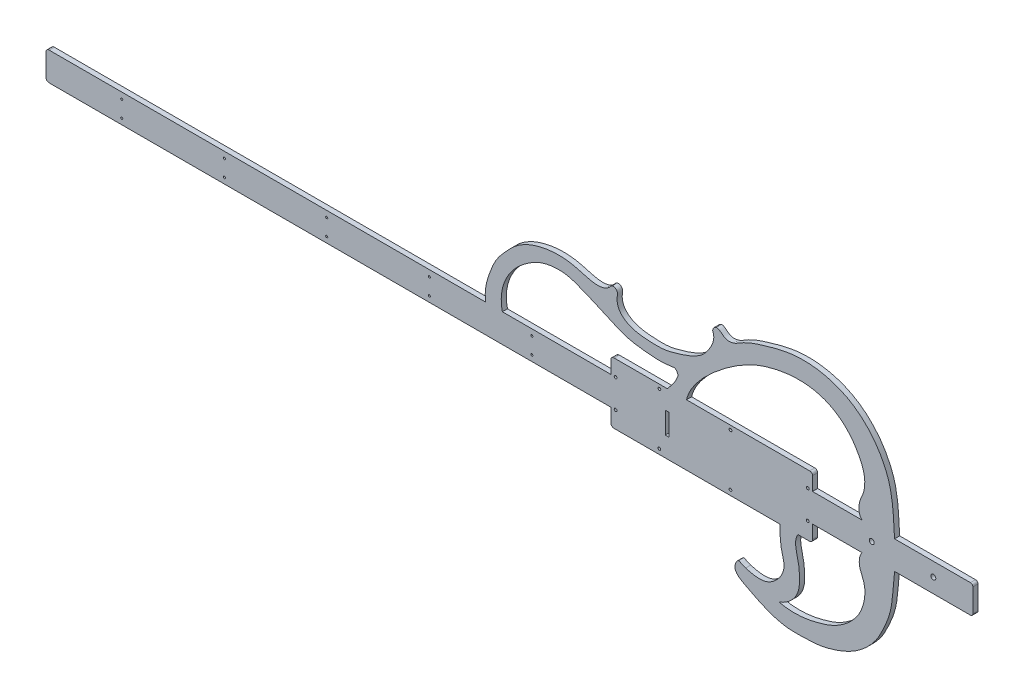
from build123d import *

# Parameters (mm, degrees)
SKETCH1_R           = 1.27
SKETCH1_R_2         = 1.720095417
SKETCH1_W           = 4.395895468
SKETCH1_H           = 26.756656412
SKETCH1_R_3         = 3.048
BOSS_EXTRUDE1_DEPTH = 6.35


with BuildPart() as part:
    # Sketch1 → Boss-Extrude1 (new body)
    with BuildSketch(Plane.XY):
        with BuildLine():
            Line((0.359622665, 112.547896558), (0.359622665, 84.647626996))
            ThreePointArc((0.359622665, 84.647626996), (1.569547298, 82.016705042), (4.285435965, 81.011908201))
            Line((4.285435965, 81.011908201), (699.960441306, 81.011908201))
            Line((699.960441306, 81.011908201), (699.960441306, 64.012598058))
            ThreePointArc((699.960441306, 64.012598058), (701.213068629, 61.288906282), (704.024750828, 60.24870663))
            Line((704.024750828, 60.24870663), (909.286197208, 60.24870663))
            add(Edge.make_bspline(
                [(866.883440258, -8.016888538), (874.996208069, -10.630011106), (889.582465134, -13.349674555), (904.754102276, -2.95793798), (912.646405573, 6.979428185), (915.467454602, 19.076193935), (909.876881939, 35.950201477), (909.359928546, 49.852763393), (909.286197208, 60.24870663)],
                knots=[0, 0, 0, 0, 0.253575557, 0.369607886, 0.505308287, 0.606582736, 0.705767559, 1, 1, 1, 1], degree=3))
            add(Edge.make_bspline(
                [(1051.373524781, 80.56870663), (1049.288127142, 64.650526229), (1049.88818517, 41.15296277), (1038.960901756, 14.635351575), (1030.033721858, -4.003031853), (1016.302858841, -19.587670347), (998.930235011, -32.049495928), (980.710504271, -39.994799999), (959.57894918, -45.955528305), (938.108660724, -46.630190525), (916.713848936, -46.888472713), (897.902005788, -41.731666781), (880.789552489, -34.28420289), (867.524414432, -27.199547471), (857.757493082, -22.04011477), (853.06855917, -15.368003413), (853.869053657, -9.281082738), (857.872680057, -3.254162116), (861.84748545, -6.487186688), (866.865577861, -8.023744377), (866.883440258, -8.016888538)],
                knots=[0, 0, 0, 0, 0.159781432, 0.22073232, 0.278896856, 0.361243423, 0.420244649, 0.486730637, 0.554562609, 0.633412937, 0.695861611, 0.762776951, 0.821949522, 0.878083655, 0.910083505, 0.929117979, 0.952627265, 0.969674335, 0.9829837, 1, 1, 1, 1], degree=3))
            Line((1051.373524781, 80.56870663), (1145.318968911, 80.56870663))
            ThreePointArc((1145.318968911, 80.56870663), (1147.47423038, 81.461445161), (1148.366968911, 83.61670663))
            Line((1148.366968911, 83.61670663), (1148.366968911, 112.444795653))
            ThreePointArc((1148.366968911, 112.444795653), (1147.47423038, 114.600057122), (1145.318968911, 115.492795653))
            Line((1145.318968911, 115.492795653), (1051.373524781, 115.492795653))
            add(Edge.make_bspline(
                [(1051.373524781, 115.492795653), (1050.085567845, 133.585169118), (1050.031748592, 165.853529466), (1030.489653884, 206.366381772), (1004.666685748, 232.661355303), (969.814698833, 248.855889629), (929.466791914, 253.119967796), (892.243263272, 243.135991048), (865.879505599, 234.346324949), (852.301494449, 224.647253002), (841.392349307, 224.656843506), (837.099080275, 229.209023083), (833.914039429, 231.303054702), (831.844974328, 232.226406665), (826.87829078, 231.174808269), (825.340112102, 226.071477889), (826.846296928, 223.844416195)],
                knots=[0, 0, 0, 0, 0.170259048, 0.292846894, 0.408935013, 0.505972757, 0.64534917, 0.775869817, 0.861927566, 0.902740597, 0.927960686, 0.955006989, 0.957766717, 0.963493972, 0.975689055, 1, 1, 1, 1], degree=3))
            add(Edge.make_bspline(
                [(826.846296928, 223.844416195), (828.1441551, 219.815491892), (826.405981943, 211.963531121), (820.920958395, 202.620715011), (814.303227062, 194.177043953), (801.537014519, 185.882402122), (784.687293461, 180.181940997), (764.518925037, 174.766393306), (746.225954239, 175.722168548), (729.920820026, 177.231385826), (717.783284419, 182.225149694), (709.22312443, 190.233303454), (707.268395716, 199.202588574), (708.098277515, 205.104454515), (708.418453014, 210.901354403), (702.511886729, 213.413706755), (699.960441306, 210.973496645)],
                knots=[0, 0, 0, 0, 0.072482113, 0.13088373, 0.189047214, 0.256659028, 0.3915451, 0.49712301, 0.616589293, 0.706951108, 0.780369561, 0.840844517, 0.903160581, 0.929303787, 0.945816026, 1, 1, 1, 1], degree=3))
            add(Edge.make_bspline(
                [(545.068679485, 116.18243367), (543.003944869, 127.306395669), (547.835188666, 146.50666263), (557.831391281, 170.078633417), (570.229050884, 183.087633665), (580.719792418, 194.642079707), (593.5777802, 202.996739544), (609.448319418, 208.86698225), (626.176829351, 211.953667548), (643.646109213, 212.256774791), (659.486622395, 208.88988684), (672.366772331, 204.896746195), (683.479003472, 202.983497948), (693.477852728, 204.629583715), (698.499191276, 208.660666551), (699.960441306, 210.973496645)],
                knots=[0, 0, 0, 0, 0.155145898, 0.270667715, 0.352919031, 0.403875103, 0.488427755, 0.56351451, 0.63903581, 0.725011604, 0.805518134, 0.863878342, 0.913359786, 0.962090462, 1, 1, 1, 1], degree=3))
            Line((545.068679485, 116.18243367), (4.285435965, 116.18243367))
            ThreePointArc((4.285435965, 116.18243367), (1.569792033, 115.17822767), (0.359622665, 112.547896558))
        make_face()
        with BuildLine():
            Line((699.960441306, 116.18243367), (565.564682143, 116.18243367))
            add(Edge.make_bspline(
                [(565.564682143, 116.18243367), (563.226872964, 126.247558426), (564.563870169, 146.978403139), (579.525164002, 170.383648282), (596.804717428, 184.496588222), (611.973268858, 192.885941946), (627.707346003, 196.323282932), (644.186801908, 196.673574965), (660.931161335, 190.919967617), (679.49477656, 183.346510635), (699.584741427, 173.632525371), (720.745026095, 164.98841516), (746.494131876, 161.433333264), (764.358224053, 160.291522579), (775.870604305, 162.344713358)],
                knots=[0, 0, 0, 0, 0.116254019, 0.223750827, 0.302299532, 0.366198057, 0.416538643, 0.482369053, 0.548714552, 0.613739129, 0.708376571, 0.800110483, 0.868979849, 1, 1, 1, 1], degree=3))
            add(Edge.make_bspline(
                [(775.870604305, 162.344713358), (779.488866181, 164.133703127), (784.519124227, 158.321863711), (781.510753604, 152.356369762), (778.113755949, 145.046519293), (773.087990045, 139.877099284), (770.011014066, 135.812795653)],
                knots=[0, 0, 0, 0, 0.303753327, 0.400343831, 0.557599877, 1, 1, 1, 1], degree=3))
            Line((770.011014066, 135.812795653), (704.024750828, 135.812795653))
            ThreePointArc((704.024750828, 135.812795653), (701.183091811, 134.700225562), (699.960441306, 131.904163347))
            Line((699.960441306, 131.904163347), (699.960441306, 116.18243367))
        make_face(mode=Mode.SUBTRACT)
        with BuildLine():
            Line((943.890172073, 135.812795653), (793.653450035, 135.812795653))
            add(Edge.make_bspline(
                [(1010.956707906, 115.492795653), (1007.967519446, 118.557852299), (1006.44520792, 126.418493459), (1008.601489172, 136.81034488), (1012.744531036, 144.329280892), (1014.208241343, 151.910712426), (1014.83521591, 160.351901877), (1012.367043029, 172.880962297), (1004.884481127, 187.9768728), (993.360653721, 203.787764201), (978.460122223, 215.511614276), (960.961741427, 223.784439146), (938.608552625, 227.832891389), (910.700110812, 226.068897979), (877.250076253, 216.870260714), (847.805509367, 198.967305375), (823.283440326, 179.180260176), (804.873915285, 159.868379039), (795.777179698, 144.642908038), (793.653450035, 135.812795653)],
                knots=[0, 0, 0, 0, 0.036323951, 0.06811831, 0.092953785, 0.112116261, 0.136404545, 0.16807032, 0.224491629, 0.285321924, 0.341045563, 0.391564503, 0.456512524, 0.541138816, 0.638971389, 0.762802321, 0.845038133, 0.919560661, 1, 1, 1, 1], degree=3))
            Line((1010.956707906, 115.492795653), (949.738968911, 115.492795653))
            Line((949.738968911, 115.492795653), (949.738968911, 132.475411377))
            ThreePointArc((949.738968911, 132.475411377), (948.657072186, 134.878542119), (946.192785632, 135.812795653))
            Line((946.192785632, 135.812795653), (943.890172073, 135.812795653))
        make_face(mode=Mode.SUBTRACT)
        with BuildLine():
            Line((949.738968911, 80.56870663), (1010.956707906, 80.56870663))
            add(Edge.make_bspline(
                [(907.924805009, -23.799079293), (924.25654034, -27.815584387), (948.454206412, -25.270778028), (978.199946498, -15.109602732), (995.962405074, -2.658838724), (1008.935667748, 13.408192449), (1014.56675733, 30.589912872), (1015.072043006, 45.322836602), (1011.233604334, 55.731662703), (1006.452327286, 66.550512981), (1007.823761663, 75.782174911), (1010.956707906, 80.56870663)],
                knots=[0, 0, 0, 0, 0.272312479, 0.391790224, 0.513826735, 0.624029674, 0.725126906, 0.806543023, 0.860469863, 0.90617368, 1, 1, 1, 1], degree=3))
            add(Edge.make_bspline(
                [(931.72901064, 60.24870663), (926.371333174, 51.921584385), (931.879117456, 36.200486978), (934.283414601, 15.747939395), (932.717203407, -7.865376158), (918.332792966, -20.46407755), (907.924805009, -23.799079293)],
                knots=[0, 0, 0, 0, 0.282393259, 0.484892607, 0.651403546, 1, 1, 1, 1], degree=3))
            Line((931.72901064, 60.24870663), (943.890172073, 60.24870663))
            Line((943.890172073, 60.24870663), (946.192785632, 60.24870663))
            ThreePointArc((946.192785632, 60.24870663), (948.74540471, 61.39621374), (949.738968911, 64.012598058))
            Line((949.738968911, 64.012598058), (949.738968911, 80.56870663))
        make_face(mode=Mode.SUBTRACT)
        with Locations((94.1622142, 88.091107164)):
            Circle(SKETCH1_R, mode=Mode.SUBTRACT)
        with Locations((221.392126764, 88.091107164)):
            Circle(SKETCH1_R, mode=Mode.SUBTRACT)
        with Locations((348.078760153, 88.091107164)):
            Circle(SKETCH1_R, mode=Mode.SUBTRACT)
        with Locations((475.146430575, 88.091107164)):
            Circle(SKETCH1_R, mode=Mode.SUBTRACT)
        with Locations((705.892847696, 81.011908201)):
            Circle(SKETCH1_R_2, mode=Mode.SUBTRACT)
        with Locations((602.130384222, 88.091107164)):
            Circle(SKETCH1_R, mode=Mode.SUBTRACT)
        with Locations((760.070975046, 66.505299661)):
            Circle(SKETCH1_R_2, mode=Mode.SUBTRACT)
        with Locations((848.138968911, 66.505299661)):
            Circle(SKETCH1_R_2, mode=Mode.SUBTRACT)
        with Locations((769.573881411, 98.171002455)):
            Rectangle(SKETCH1_W, SKETCH1_H, mode=Mode.SUBTRACT)
        with Locations((943.890172073, 81.011908201)):
            Circle(SKETCH1_R_2, mode=Mode.SUBTRACT)
        with Locations((1023.106655082, 98.527788179)):
            Circle(SKETCH1_R_3, mode=Mode.SUBTRACT)
        with Locations((1099.420523291, 98.527788179)):
            Circle(SKETCH1_R_3, mode=Mode.SUBTRACT)
        with Locations((94.1622142, 108.484732819)):
            Circle(SKETCH1_R, mode=Mode.SUBTRACT)
        with Locations((221.392126764, 108.484732819)):
            Circle(SKETCH1_R, mode=Mode.SUBTRACT)
        with Locations((348.078760153, 108.484732819)):
            Circle(SKETCH1_R, mode=Mode.SUBTRACT)
        with Locations((475.146430575, 108.484732819)):
            Circle(SKETCH1_R, mode=Mode.SUBTRACT)
        with Locations((602.130384222, 108.484732819)):
            Circle(SKETCH1_R, mode=Mode.SUBTRACT)
        with Locations((705.892847696, 116.18243367)):
            Circle(SKETCH1_R_2, mode=Mode.SUBTRACT)
        with Locations((760.070975046, 130.611938178)):
            Circle(SKETCH1_R_2, mode=Mode.SUBTRACT)
        with Locations((848.138968911, 130.611938178)):
            Circle(SKETCH1_R_2, mode=Mode.SUBTRACT)
        with Locations((943.890172073, 116.18243367)):
            Circle(SKETCH1_R_2, mode=Mode.SUBTRACT)
    extrude(amount=BOSS_EXTRUDE1_DEPTH)


solid = part.part
